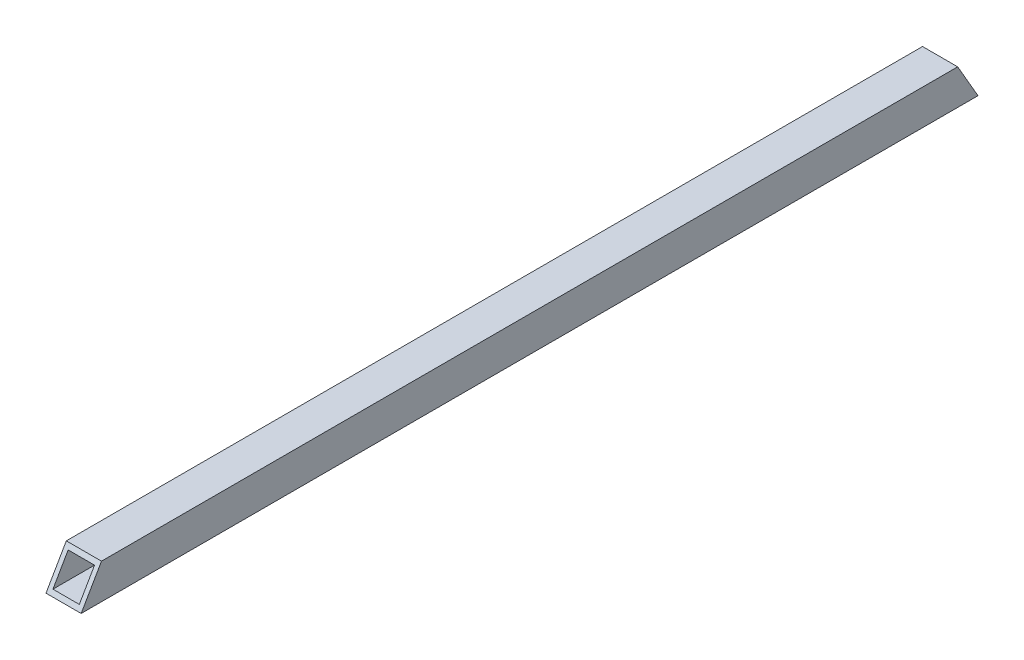
from build123d import *

# Parameters (mm, degrees)
SKETCH1_W           = 25.4
SKETCH1_H           = 25.4
SKETCH1_W_2         = 19.05
SKETCH1_H_2         = 19.05
BOSS_EXTRUDE1_DEPTH = 323.85
SKETCH2_W           = 25.4
SKETCH2_H           = 29.329393675
CUT_EXTRUDE1_DEPTH  = 281.965076789


with BuildPart() as part:
    # Sketch1 → Boss-Extrude1 (new body)
    with BuildSketch(Plane.XY):
        Rectangle(SKETCH1_W, SKETCH1_H)
        Rectangle(SKETCH1_W_2, SKETCH1_H_2, mode=Mode.SUBTRACT)
    boss_extrude1 = extrude(amount=BOSS_EXTRUDE1_DEPTH)

    # Sketch2 → Cut-Extrude1 (cut, through all)
    with BuildSketch(Plane(origin=(0, 137.056163508, 237.388238686), x_dir=(1, 0, 0), z_dir=(0, 0.4999999999999889, 0.866025403784445))):
        with Locations((0, -158.25882579)):
            Rectangle(SKETCH2_W, SKETCH2_H)
    cut_extrude1 = extrude(amount=CUT_EXTRUDE1_DEPTH, mode=Mode.SUBTRACT)

    # Mirror2: Boss-Extrude1, Cut-Extrude1 across plane
    add(boss_extrude1.mirror(Plane.XY))
    add(cut_extrude1.mirror(Plane.XY), mode=Mode.SUBTRACT)


solid = part.part
